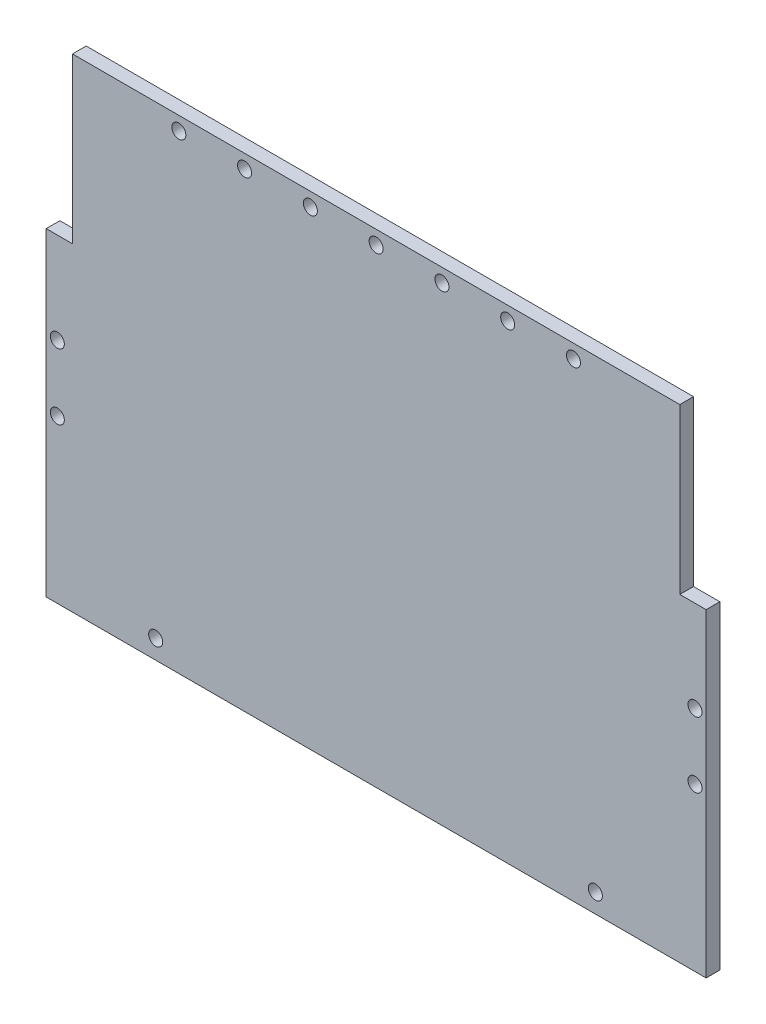
from build123d import *

# Parameters (mm, degrees)
SKETCH1_W          = 76.454
SKETCH1_H          = 56.007
EXTRUDE1_DEPTH     = 1.5875
SKETCH2_R          = 0.8128
EXTRUDE2_DEPTH     = 95.786699073
SKETCH4_R          = 0.8128
EXTRUDE3_DEPTH     = 9.525
SKETCH5_W          = 3.048
SKETCH5_H          = 19.05
EXTRUDE4_DEPTH     = 95.786699073
SKETCH6_R          = 0.8128
CUT_EXTRUDE1_DEPTH = 1.5875


with BuildPart() as part:
    # Sketch1 → Extrude1 (new body)
    with BuildSketch(Plane.XY):
        with Locations((-38.227, 28.0035)):
            Rectangle(SKETCH1_W, SKETCH1_H)
    extrude(amount=-EXTRUDE1_DEPTH)

    # Sketch2 → Extrude2 (cut, through all)
    with BuildSketch(Plane.XY):
        with Locations((-38.227, 54.42458)):
            Circle(SKETCH2_R)
        with Locations((-30.607, 54.42458)):
            Circle(SKETCH2_R)
        with Locations((-22.987, 54.42458)):
            Circle(SKETCH2_R)
        with Locations((-15.367, 54.42458)):
            Circle(SKETCH2_R)
        with Locations((-45.847, 54.42458)):
            Circle(SKETCH2_R)
        with Locations((-53.467, 54.42458)):
            Circle(SKETCH2_R)
        with Locations((-61.087, 54.42458)):
            Circle(SKETCH2_R)
    extrude(amount=-EXTRUDE2_DEPTH, mode=Mode.SUBTRACT)

    # Sketch4 → Extrude3 (cut)
    with BuildSketch(Plane.XY):
        with Locations((-75.16495, 26.416)):
            Circle(SKETCH4_R)
        with Locations((-75.16495, 18.796)):
            Circle(SKETCH4_R)
        with Locations((-1.28905, 26.416)):
            Circle(SKETCH4_R)
        with Locations((-1.28905, 18.796)):
            Circle(SKETCH4_R)
    extrude(amount=-EXTRUDE3_DEPTH, mode=Mode.SUBTRACT)

    # Sketch5 → Extrude4 (cut, through all)
    with BuildSketch(Plane.XY):
        with Locations((-74.93, 46.482)):
            Rectangle(SKETCH5_W, SKETCH5_H)
        with Locations((-1.524, 46.482)):
            Rectangle(SKETCH5_W, SKETCH5_H)
    extrude(amount=-EXTRUDE4_DEPTH, mode=Mode.SUBTRACT)

    # Sketch6 → Cut-Extrude1 (cut)
    with BuildSketch(Plane.XY):
        with Locations((-12.827, 2.20853)):
            Circle(SKETCH6_R)
        with Locations((-63.766480146, 2.20853)):
            Circle(SKETCH6_R)
    extrude(amount=-CUT_EXTRUDE1_DEPTH, mode=Mode.SUBTRACT)


solid = part.part
